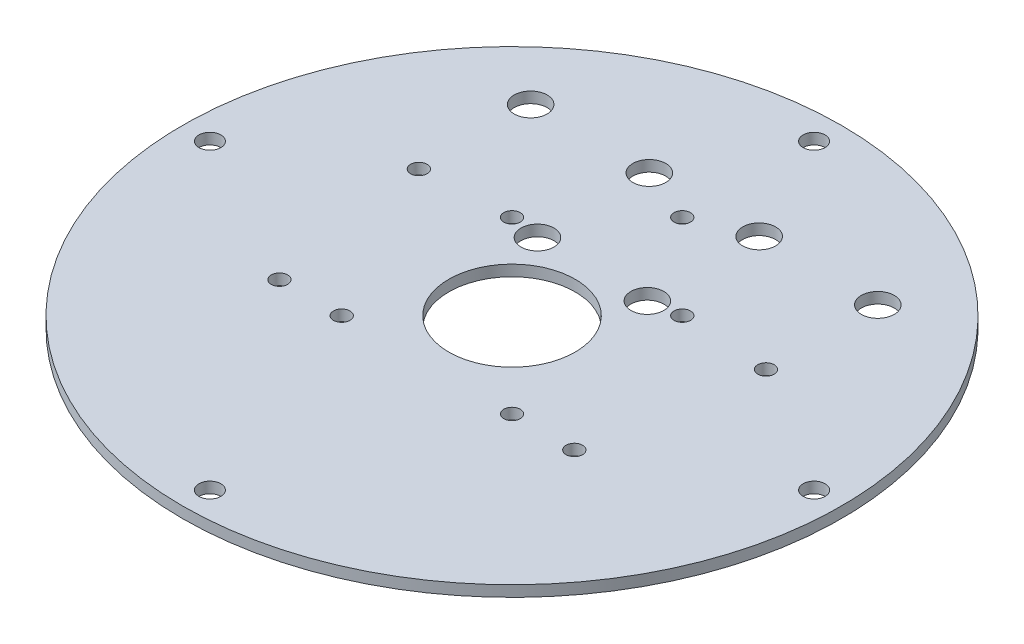
from build123d import *

# Parameters (mm, degrees)
SKETCH_1_R          = 60
SKETCH_1_R_2        = 1.5
EXTRUDE_1_DEPTH     = 2
SKETCH_3_R          = 11.5
CUT_EXTRUDE_3_DEPTH = 2
SKETCH_4_R          = 1.5
CUT_EXTRUDE_4_DEPTH = 2
SKETCH_5_R          = 3
CUT_EXTRUDE_5_DEPTH = 10
SKETCH_6_R          = 2
CUT_EXTRUDE_6_DEPTH = 10
SKETCH_7_R          = 3
CUT_EXTRUDE_7_DEPTH = 10
SKETCH_8_R          = 3
CUT_EXTRUDE_8_DEPTH = 10
SKETCH_9_R          = 1.5
CUT_EXTRUDE_9_DEPTH = 10


with BuildPart() as part:
    # 草图1 → 凸台-拉伸1 (new body)
    with BuildSketch(Plane(origin=(0, 0, 0), x_dir=(1, 0, 0), z_dir=(0, 1, 0))):
        with Locations(Location((0, 0, 0), (0, 0, 270))):
            Circle(SKETCH_1_R)
        with Locations(Location((0, 31, 0), (0, 0, 270))):
            Circle(SKETCH_1_R_2, mode=Mode.SUBTRACT)
        with Locations(Location((26.846787517, -15.5, 0), (0, 0, 270))):
            Circle(SKETCH_1_R_2, mode=Mode.SUBTRACT)
        with Locations(Location((-26.846787517, -15.5, 0), (0, 0, 270))):
            Circle(SKETCH_1_R_2, mode=Mode.SUBTRACT)
    extrude(amount=EXTRUDE_1_DEPTH)

    # 草图3 → 切除-拉伸3 (cut)
    with BuildSketch(Plane(origin=(0, 2, 0), x_dir=(1, 0, 0), z_dir=(0, 1, 0))):
        with Locations(Location((0, 0, 0), (0, 0, 270))):
            Circle(SKETCH_3_R)
    extrude(amount=-CUT_EXTRUDE_3_DEPTH, mode=Mode.SUBTRACT)

    # 草图4 → 切除-拉伸4 (cut)
    with BuildSketch(Plane(origin=(0, 2, 0), x_dir=(1, 0, 0), z_dir=(0, 1, 0))):
        with Locations(Location((-15.5, 15.5, 0), (0, 0, 270))):
            Circle(SKETCH_4_R)
        with Locations(Location((15.5, 15.5, 0), (0, 0, 270))):
            Circle(SKETCH_4_R)
        with Locations(Location((15.5, -15.5, 0), (0, 0, 270))):
            Circle(SKETCH_4_R)
        with Locations(Location((-15.5, -15.5, 0), (0, 0, 270))):
            Circle(SKETCH_4_R)
    extrude(amount=-CUT_EXTRUDE_4_DEPTH, mode=Mode.SUBTRACT)

    # 草图5 → 切除-拉伸5 (cut)
    with BuildSketch(Plane.XZ):
        with Locations(Location((10, -14.64, 0), (0, 0, 270))):
            Circle(SKETCH_5_R)
        with Locations(Location((-10, -14.64, 0), (0, 0, 270))):
            Circle(SKETCH_5_R)
    extrude(amount=-CUT_EXTRUDE_5_DEPTH, mode=Mode.SUBTRACT)

    # 草图6 → 切除-拉伸6 (cut)
    with BuildSketch(Plane.XZ):
        with Locations(Location((0, 55, 0), (0, 0, 270))):
            Circle(SKETCH_6_R)
        with Locations(Location((55, 0, 0), (0, 0, 270))):
            Circle(SKETCH_6_R)
        with Locations(Location((0, -55, 0), (0, 0, 270))):
            Circle(SKETCH_6_R)
        with Locations(Location((-55, 0, 0), (0, 0, 270))):
            Circle(SKETCH_6_R)
    extrude(amount=-CUT_EXTRUDE_6_DEPTH, mode=Mode.SUBTRACT)

    # 草图7 → 切除-拉伸7 (cut)
    with BuildSketch(Plane.XZ):
        with Locations(Location((10, -35, 0), (0, 0, 270))):
            Circle(SKETCH_7_R)
        with Locations(Location((-10, -35, 0), (0, 0, 270))):
            Circle(SKETCH_7_R)
    extrude(amount=-CUT_EXTRUDE_7_DEPTH, mode=Mode.SUBTRACT)

    # 草图8 → 切除-拉伸8 (cut)
    with BuildSketch(Plane.XZ):
        with Locations(Location((31.6, -35, 0), (0, 0, 270))):
            Circle(SKETCH_8_R)
        with Locations(Location((-31.6, -35, 0), (0, 0, 270))):
            Circle(SKETCH_8_R)
    extrude(amount=-CUT_EXTRUDE_8_DEPTH, mode=Mode.SUBTRACT)

    # 草图9 → 切除-拉伸9 (cut)
    with BuildSketch(Plane.XZ):
        with Locations(Location((-31.6, -14.64, 0), (0, 0, 270))):
            Circle(SKETCH_9_R)
        with Locations(Location((31.6, -14.64, 0), (0, 0, 270))):
            Circle(SKETCH_9_R)
    extrude(amount=-CUT_EXTRUDE_9_DEPTH, mode=Mode.SUBTRACT)


solid = part.part
